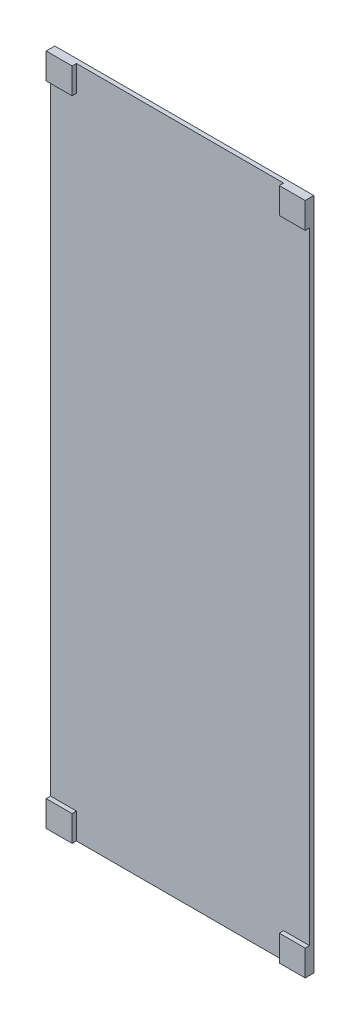
from build123d import *

# Parameters (mm, degrees)
SKETCH1_W           = 1524
SKETCH1_H           = 3962.4
BOSS_EXTRUDE1_DEPTH = 25.4
SKETCH2_W           = 152.4
SKETCH2_H           = 152.4
BOSS_EXTRUDE2_DEPTH = 25.4


with BuildPart() as part:
    # Sketch1 → Boss-Extrude1 (new body)
    with BuildSketch(Plane.XY):
        with Locations((762, 1981.2)):
            Rectangle(SKETCH1_W, SKETCH1_H)
    extrude(amount=BOSS_EXTRUDE1_DEPTH)

    # Sketch2 → Boss-Extrude2 (add)
    with BuildSketch(Plane.XY.offset(25.4)):
        with Locations((76.2, 3886.2)):
            Rectangle(SKETCH2_W, SKETCH2_H)
        with Locations((1447.8, 3886.2)):
            Rectangle(SKETCH2_W, SKETCH2_H)
        with Locations((1447.8, 76.2)):
            Rectangle(SKETCH2_W, SKETCH2_H)
        with Locations((76.2, 76.2)):
            Rectangle(SKETCH2_W, SKETCH2_H)
    extrude(amount=BOSS_EXTRUDE2_DEPTH)


solid = part.part
